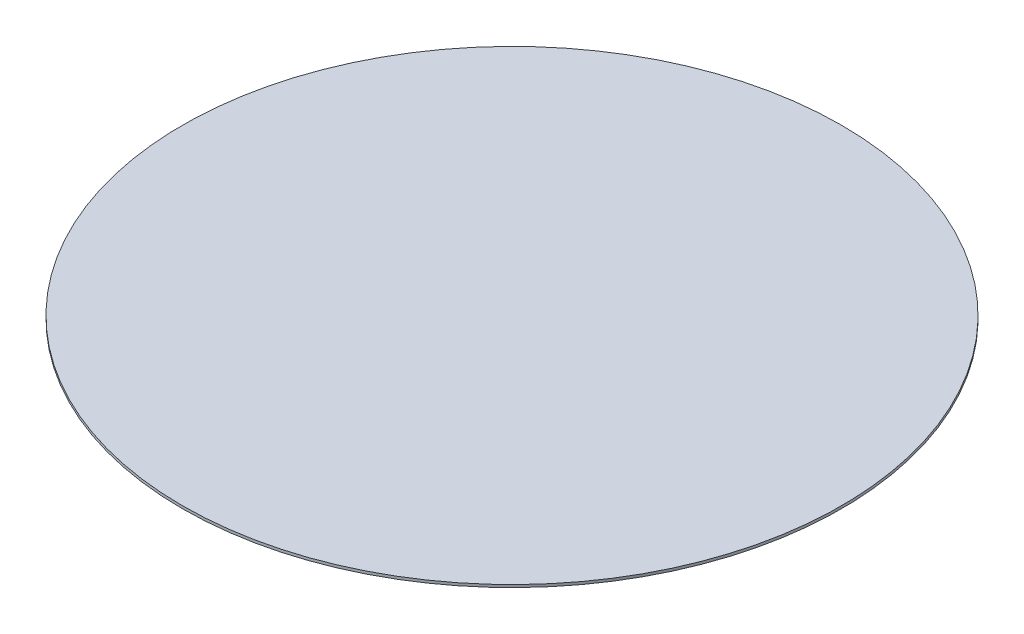
from build123d import *

# Parameters (mm, degrees)
SKETCH1_R           = 95.25
BOSS_EXTRUDE1_DEPTH = 0.762


with BuildPart() as part:
    # Sketch1 → Boss-Extrude1 (new body)
    with BuildSketch(Plane(origin=(0, 0, 0), x_dir=(1, 0, 0), z_dir=(0, 1, 0))):
        with Locations(Location((0, 0, 0), (0, 0, 90))):
            Circle(SKETCH1_R)
    extrude(amount=BOSS_EXTRUDE1_DEPTH)


solid = part.part
